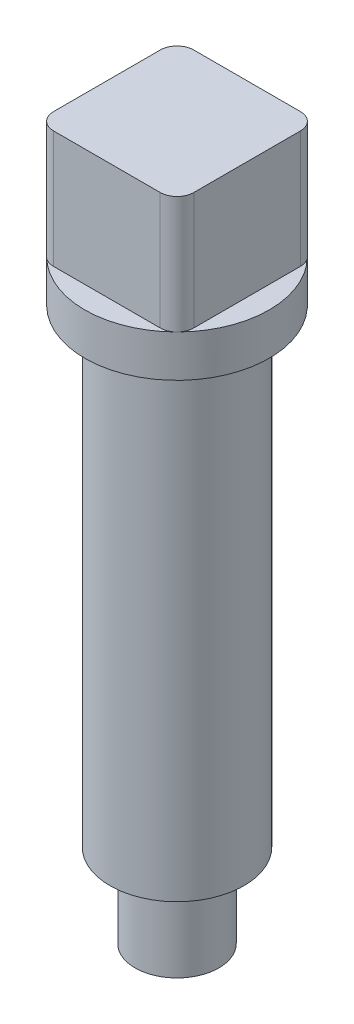
from build123d import *

# Parameters (mm, degrees)
Y_KSEKLIK_EKSTR_ZYON1_DEPTH = 14


with BuildPart() as part:
    # Çizim2 → Döndür1 (revolve)
    with BuildSketch(Plane.XY, mode=Mode.PRIVATE) as d_nd_r1_sk:
        Polygon((0, 0), (5, 0), (5, 10), (8, 10), (8, 66), (11, 66), (11, 71), (0, 71), align=None)
    revolve(d_nd_r1_sk.sketch.rotate(Axis((0, 71, 0), (0, -1, 0)), 180), axis=Axis((0, 71, 0), (0, -1, 0)))

    # Çizim3 → Yükseklik-Ekstrüzyon1 (add)
    with BuildSketch(Plane(origin=(0, 71, 0), x_dir=(1, 0, 0), z_dir=(0, 1, 0))):
        with BuildLine():
            Line((-6.363961031, 8.363961031), (6.363961031, 8.363961031))
            ThreePointArc((6.363961031, 8.363961031), (7.778174593, 7.778174593), (8.363961031, 6.363961031))
            Line((8.363961031, 6.363961031), (8.363961031, -6.363961031))
            ThreePointArc((8.363961031, -6.363961031), (7.778174593, -7.778174593), (6.363961031, -8.363961031))
            Line((6.363961031, -8.363961031), (-6.363961031, -8.363961031))
            ThreePointArc((-6.363961031, -8.363961031), (-7.778174593, -7.778174593), (-8.363961031, -6.363961031))
            Line((-8.363961031, -6.363961031), (-8.363961031, 6.363961031))
            ThreePointArc((-8.363961031, 6.363961031), (-7.778174593, 7.778174593), (-6.363961031, 8.363961031))
        make_face()
    extrude(amount=Y_KSEKLIK_EKSTR_ZYON1_DEPTH)


solid = part.part
